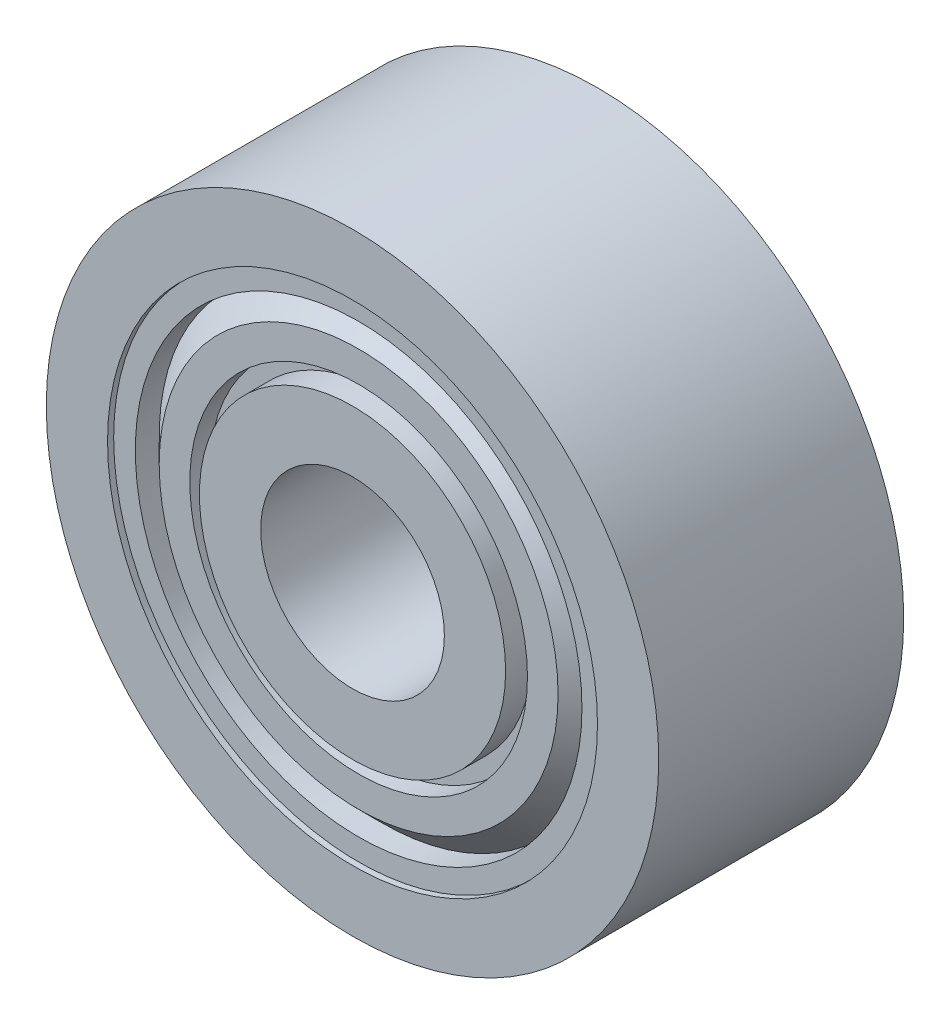
from build123d import *


with BuildPart() as part:
    # Esquisse2 → Révolution1 (revolve)
    with BuildSketch(Plane(origin=(0, 0, 0), x_dir=(0, 0, -1), z_dir=(1, 0, 0)), mode=Mode.PRIVATE) as r_volution1_sk:
        Polygon((2, 1.5), (-2, 1.5), (-2, 2.5), (-1.574731183, 2.5), (-1.574731183, 2.75672043), (-1.9, 2.75672043), (-1.9, 3.25672043), (-1.510215054, 3.646505376), (-1.9, 3.646505376), (-1.9, 4), (-2, 4), (-2, 5), (2, 5), (2, 4), (1.9, 4), (1.9, 3.646505376), (1.510215054, 3.646505376), (1.9, 3.25672043), (1.9, 2.75672043), (1.574731183, 2.75672043), (1.574731183, 2.5), (2, 2.5), align=None)
    revolve(r_volution1_sk.sketch.rotate(Axis((0, 0, 4.422043011), (0, 0, -1)), 90), axis=Axis((0, 0, 4.422043011), (0, 0, -1)))


solid = part.part
